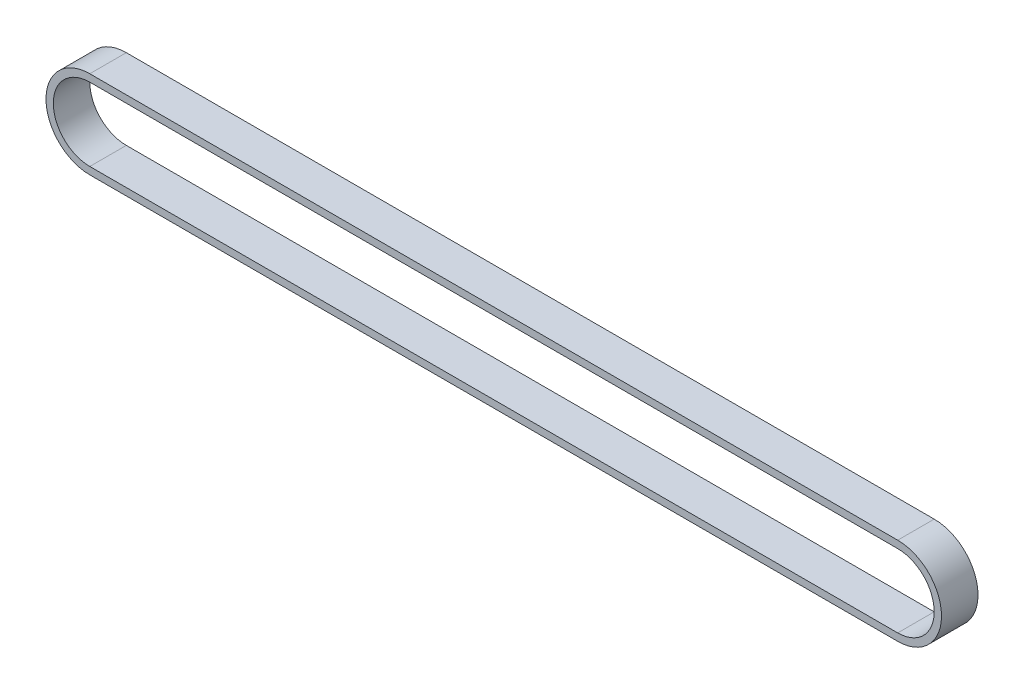
from build123d import *

# Parameters (mm, degrees)
EXTRUDE_1_DEPTH = 15


with BuildPart() as part:
    # 草图1 → 凸台-拉伸1 (new body)
    with BuildSketch(Plane.XY):
        with BuildLine():
            Line((0, -18), (-332, -18))
            ThreePointArc((-332, -18), (-350, 0), (-332, 18))
            Line((-332, 18), (0, 18))
            ThreePointArc((0, 18), (18, 0), (0, -18))
        make_face()
        with BuildLine():
            Line((0, -15), (-332, -15))
            ThreePointArc((-332, -15), (-347, 0), (-332, 15))
            Line((-332, 15), (0, 15))
            ThreePointArc((0, 15), (15, 0), (0, -15))
        make_face(mode=Mode.SUBTRACT)
    extrude(amount=EXTRUDE_1_DEPTH)


solid = part.part
